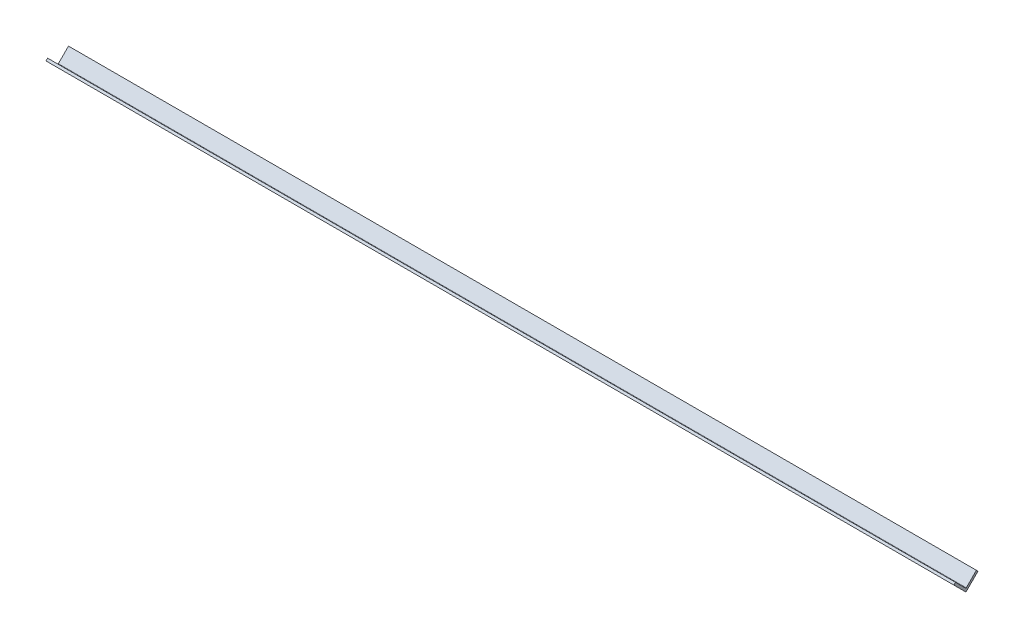
from build123d import *

# Parameters (mm, degrees)
BOSS_EXTRUDE1_DEPTH = 1012


with BuildPart() as part:
    # Sketch1 → Boss-Extrude1 (new body)
    with BuildSketch(Plane(origin=(0, 0, 0), x_dir=(0, 0, -1), z_dir=(1, 0, 0))):
        with BuildLine():
            Line((0.353553391, 0.353553391), (13.435028843, 13.435028843))
            Line((13.435028843, 13.435028843), (11.638977618, 15.231080067))
            Line((11.638977618, 15.231080067), (0.353553391, 3.945655839))
            ThreePointArc((0.353553391, 3.945655839), (0, 3.79920923), (-0.353553391, 3.945655839))
            Line((-0.353553391, 3.945655839), (-11.638977618, 15.231080067))
            Line((-11.638977618, 15.231080067), (-13.435028843, 13.435028843))
            Line((-13.435028843, 13.435028843), (-0.353553391, 0.353553391))
            ThreePointArc((-0.353553391, 0.353553391), (0, 0.207106781), (0.353553391, 0.353553391))
        make_face()
    extrude(amount=BOSS_EXTRUDE1_DEPTH)


solid = part.part
